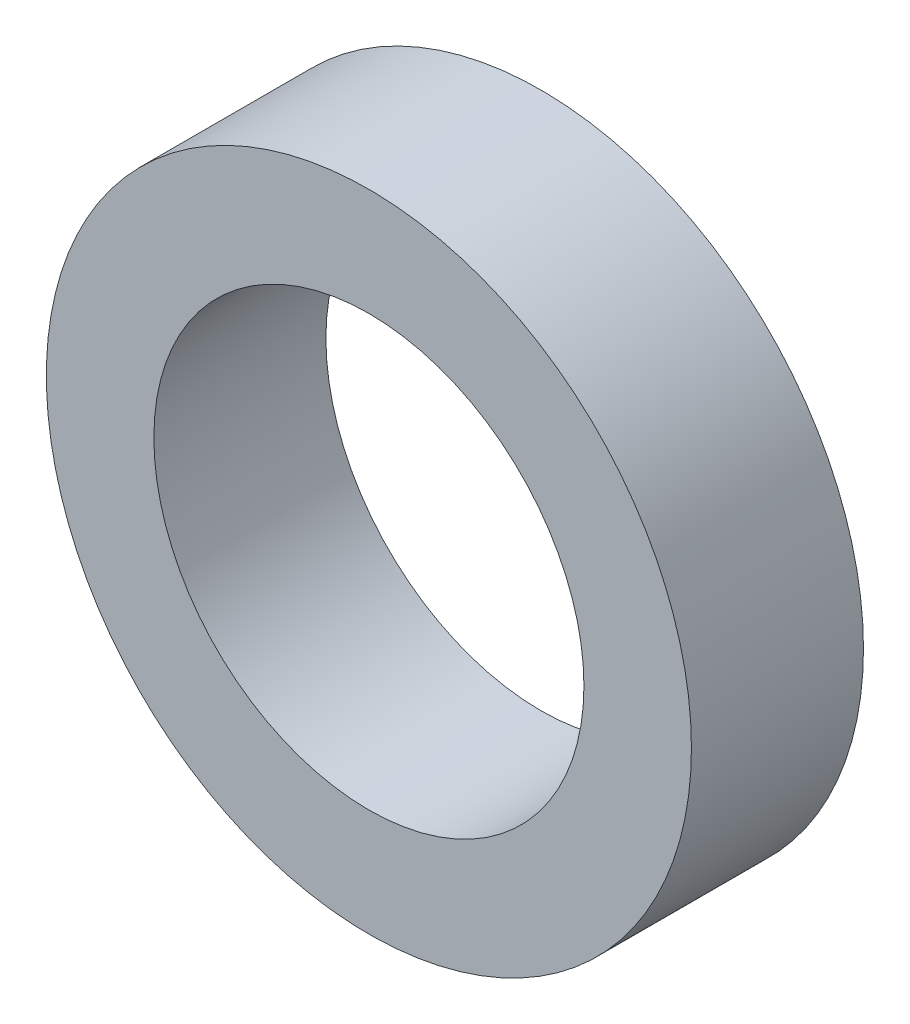
from build123d import *

# Parameters (mm, degrees)
SKETCH1_R           = 7.5
SKETCH1_R_2         = 5
BOSS_EXTRUDE1_DEPTH = 4


with BuildPart() as part:
    # Sketch1 → Boss-Extrude1 (new body)
    with BuildSketch(Plane(origin=(0, 0, 0), x_dir=(0, 1, 0), z_dir=(0, 0, 1))):
        with Locations(Location((0, 0, 0), (0, 0, 270))):
            Circle(SKETCH1_R)
        with Locations(Location((0, 0, 0), (0, 0, 270))):
            Circle(SKETCH1_R_2, mode=Mode.SUBTRACT)
    extrude(amount=BOSS_EXTRUDE1_DEPTH)


solid = part.part
